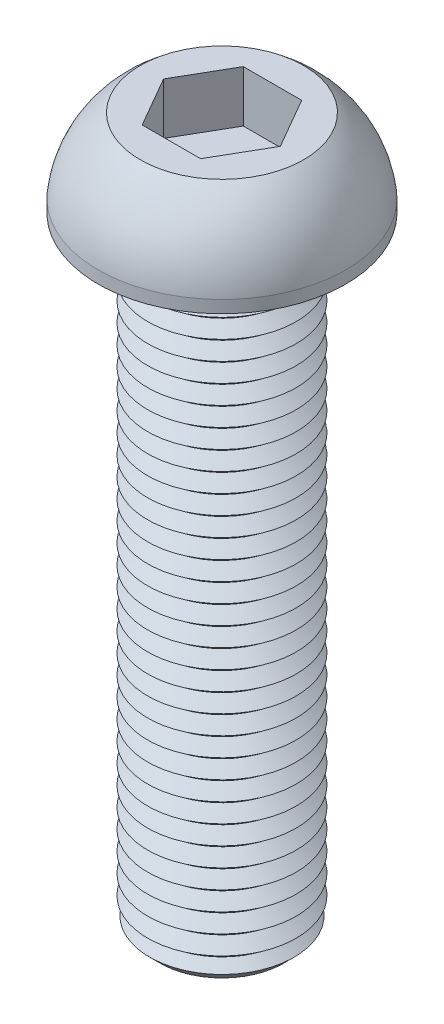
from build123d import *

# Parameters (mm, degrees)
CUT_EXTRUDE_1_DEPTH = 2.08


with BuildPart() as part:
    # 草图1 → 旋转1 (revolve)
    with BuildSketch(Plane.XY, mode=Mode.PRIVATE) as revolve_1_sk:
        with BuildLine():
            Line((2.5, 0), (0, 0))
            Line((0, 0), (0, 28.5))
            Line((0, 28.5), (3.3, 28.5))
            ThreePointArc((3.3, 28.5), (4.466476871, 27.179336894), (5, 25.5))
            Line((5, 25.5), (5, 25))
            Line((5, 25), (3, 25))
            Line((3, 25), (2.5, 24.614874776))
            Line((2.5, 24.614874776), (3, 24.229749551))
            Line((3, 24.229749551), (2.5, 23.844624327))
            Line((2.5, 23.844624327), (3, 23.459499102))
            Line((3, 23.459499102), (2.5, 23.074373878))
            Line((2.5, 23.074373878), (3, 22.689248653))
            Line((3, 22.689248653), (2.5, 22.304123429))
            Line((2.5, 22.304123429), (3, 21.918998204))
            Line((3, 21.918998204), (2.5, 21.53387298))
            Line((2.5, 21.53387298), (3, 21.148747755))
            Line((3, 21.148747755), (2.5, 20.763622531))
            Line((2.5, 20.763622531), (3, 20.378497306))
            Line((3, 20.378497306), (2.5, 19.993372082))
            Line((2.5, 19.993372082), (3, 19.608246857))
            Line((3, 19.608246857), (2.5, 19.223121633))
            Line((2.5, 19.223121633), (3, 18.837996408))
            Line((3, 18.837996408), (2.5, 18.452871184))
            Line((2.5, 18.452871184), (3, 18.06774596))
            Line((3, 18.06774596), (2.5, 17.682620735))
            Line((2.5, 17.682620735), (3, 17.297495511))
            Line((3, 17.297495511), (2.5, 16.912370286))
            Line((2.5, 16.912370286), (3, 16.527245062))
            Line((3, 16.527245062), (2.5, 16.142119837))
            Line((2.5, 16.142119837), (3, 15.756994613))
            Line((3, 15.756994613), (2.5, 15.371869388))
            Line((2.5, 15.371869388), (3, 14.986744164))
            Line((3, 14.986744164), (2.5, 14.601618939))
            Line((2.5, 14.601618939), (3, 14.216493715))
            Line((3, 14.216493715), (2.5, 13.83136849))
            Line((2.5, 13.83136849), (3, 13.446243266))
            Line((3, 13.446243266), (2.5, 13.061118041))
            Line((2.5, 13.061118041), (3, 12.675992817))
            Line((3, 12.675992817), (2.5, 12.290867592))
            Line((2.5, 12.290867592), (3, 11.905742368))
            Line((3, 11.905742368), (2.5, 11.520617143))
            Line((2.5, 11.520617143), (3, 11.135491919))
            Line((3, 11.135491919), (2.5, 10.750366695))
            Line((2.5, 10.750366695), (3, 10.36524147))
            Line((3, 10.36524147), (2.5, 9.980116246))
            Line((2.5, 9.980116246), (3, 9.594991021))
            Line((3, 9.594991021), (2.5, 9.209865797))
            Line((2.5, 9.209865797), (3, 8.824740572))
            Line((3, 8.824740572), (2.5, 8.439615348))
            Line((2.5, 8.439615348), (3, 8.054490123))
            Line((3, 8.054490123), (2.5, 7.669364899))
            Line((2.5, 7.669364899), (3, 7.284239674))
            Line((3, 7.284239674), (2.5, 6.89911445))
            Line((2.5, 6.89911445), (3, 6.513989225))
            Line((3, 6.513989225), (2.5, 6.128864001))
            Line((2.5, 6.128864001), (3, 5.743738776))
            Line((3, 5.743738776), (2.5, 5.358613552))
            Line((2.5, 5.358613552), (3, 4.973488327))
            Line((3, 4.973488327), (2.5, 4.588363103))
            Line((2.5, 4.588363103), (3, 4.203237879))
            Line((3, 4.203237879), (2.5, 3.818112654))
            Line((2.5, 3.818112654), (3, 3.43298743))
            Line((3, 3.43298743), (2.5, 3.047862205))
            Line((2.5, 3.047862205), (3, 2.662736981))
            Line((3, 2.662736981), (2.5, 2.277611756))
            Line((2.5, 2.277611756), (3, 1.892486532))
            Line((3, 1.892486532), (2.5, 1.507361307))
            Line((2.5, 1.507361307), (3, 1.122236083))
            Line((3, 1.122236083), (2.5, 0.737110858))
            Line((2.5, 0.737110858), (2.916387895, 0.416387895))
            Line((2.916387895, 0.416387895), (2.5, 0))
        make_face()
    revolve(revolve_1_sk.sketch.rotate(Axis((0, 25.075303233, 0), (0, 1, 0)), 90), axis=Axis((0, 25.075303233, 0), (0, 1, 0)))

    # 草图3 → 切除-拉伸1 (cut)
    with BuildSketch(Plane(origin=(0, 28.5, 0), x_dir=(1, 0, 0), z_dir=(0, 1, 0))):
        Polygon((2.357898499, 0), (1.17894925, 2.042), (-1.17894925, 2.042), (-2.357898499, 0), (-1.17894925, -2.042), (1.17894925, -2.042), align=None)
    extrude(amount=-CUT_EXTRUDE_1_DEPTH, mode=Mode.SUBTRACT)


solid = part.part
